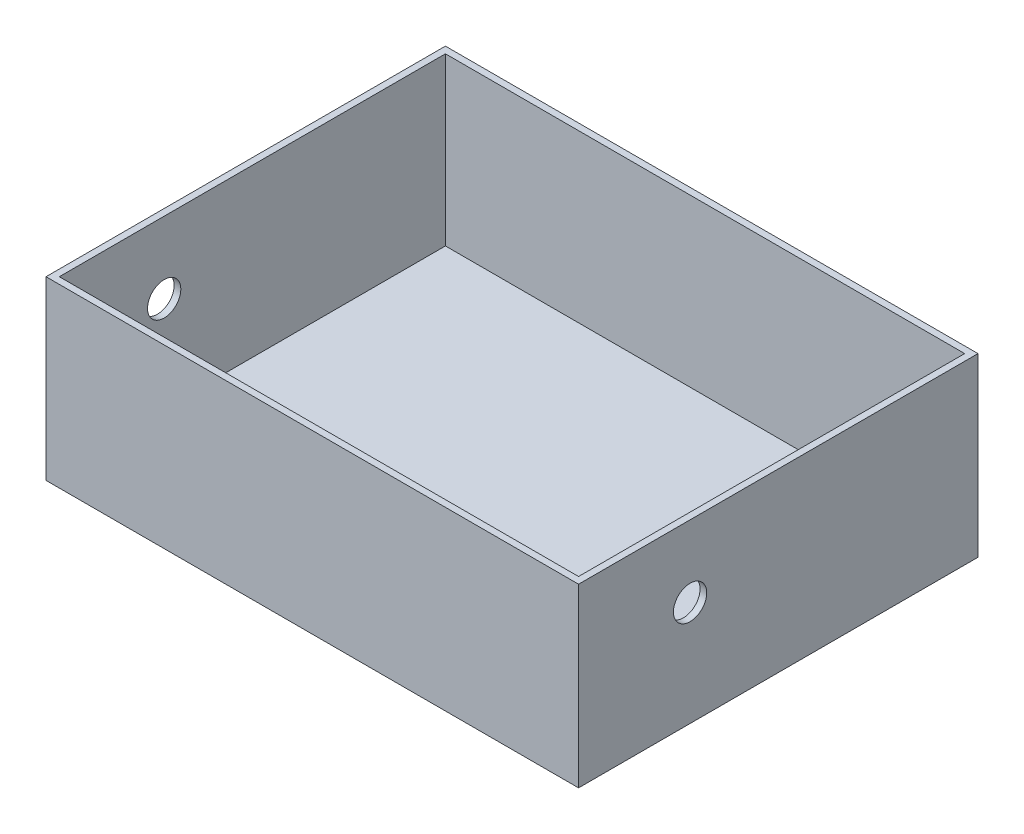
from build123d import *

# Parameters (mm, degrees)
SKETCH1_W           = 160
SKETCH1_H           = 120
BOSS_EXTRUDE1_DEPTH = 3
SKETCH2_W           = 160
SKETCH2_H           = 120
SKETCH2_W_2         = 156
SKETCH2_H_2         = 116
BOSS_EXTRUDE2_DEPTH = 50
SKETCH3_R           = 5
CUT_EXTRUDE1_DEPTH  = 179.910592196


with BuildPart() as part:
    # Sketch1 → Boss-Extrude1 (new body)
    with BuildSketch(Plane(origin=(0, 0, 0), x_dir=(1, 0, 0), z_dir=(0, 1, 0))):
        Rectangle(SKETCH1_W, SKETCH1_H)
    extrude(amount=BOSS_EXTRUDE1_DEPTH)

    # Sketch2 → Boss-Extrude2 (add)
    with BuildSketch(Plane(origin=(0, 3, 0), x_dir=(1, 0, 0), z_dir=(0, 1, 0))):
        Rectangle(SKETCH2_W, SKETCH2_H)
        Rectangle(SKETCH2_W_2, SKETCH2_H_2, mode=Mode.SUBTRACT)
    extrude(amount=BOSS_EXTRUDE2_DEPTH)

    # Sketch3 → Cut-Extrude1 (cut, through all)
    with BuildSketch(Plane(origin=(80, 0, 0), x_dir=(0, 0, -1), z_dir=(1, 0, 0))):
        with Locations((-26.5, 31.5)):
            Circle(SKETCH3_R)
    extrude(amount=-CUT_EXTRUDE1_DEPTH, mode=Mode.SUBTRACT)


solid = part.part
